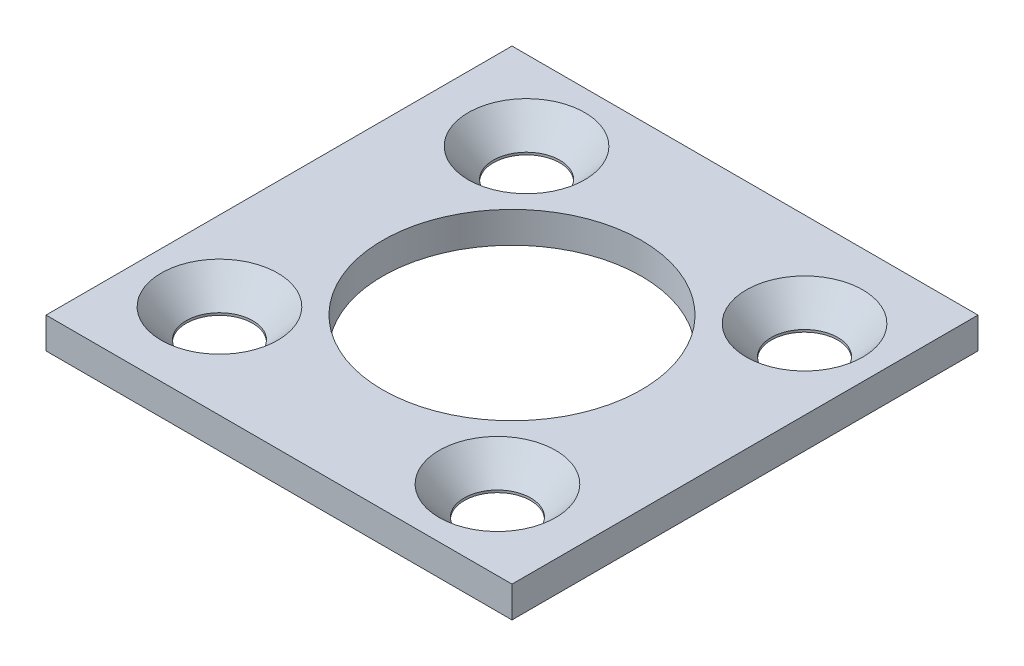
from build123d import *

# Parameters (mm, degrees)
SKETCH1_W                                     = 22.86
SKETCH1_H                                     = 22.86
SKETCH1_R                                     = 6.35
BOSS_EXTRUDE1_DEPTH                           = 1.524
CSK_FOR_4_FLAT_HEAD_MACHINE_SCREW1_AT_2_COUNT = 2
CSK_FOR_4_FLAT_HEAD_MACHINE_SCREW1_AT_2_PITCH = 14.368409794
CSK_FOR_4_FLAT_HEAD_MACHINE_SCREW1_AT_3_COUNT = 2
CSK_FOR_4_FLAT_HEAD_MACHINE_SCREW1_AT_3_PITCH = 20.32
CSK_FOR_4_FLAT_HEAD_MACHINE_SCREW1_AT_4_COUNT = 2
CSK_FOR_4_FLAT_HEAD_MACHINE_SCREW1_AT_4_PITCH = 14.368409794


with BuildPart() as part:
    # Sketch1 → Boss-Extrude1 (new body)
    with BuildSketch(Plane(origin=(0, 0, 0), x_dir=(1, 0, 0), z_dir=(0, 1, 0))):
        with Locations((-11.43, 11.43)):
            Rectangle(SKETCH1_W, SKETCH1_H)
        with Locations(Location((-11.43, 11.43, 0), (0, 0, 90))):
            Circle(SKETCH1_R, mode=Mode.SUBTRACT)
    extrude(amount=BOSS_EXTRUDE1_DEPTH)

    # Sketch3 → CSK for #4 Flat Head Machine Screw1 (revolve, cut)
    with BuildSketch(Plane(origin=(-3.897724655, 1.524, -18.248388969), x_dir=(0, 0, 1), z_dir=(1, 0, 0))):
        Polygon((0, 0), (0, 1.524), (1.63195, 1.524), (1.63195, 1.409834001), (2.8575, 0), align=None)
    csk_for_4_flat_head_machine_screw1 = revolve(axis=Axis((-3.897724655, 7.874, -18.248388969), (0, -1, 0)), mode=Mode.SUBTRACT)

    # CSK for #4 Flat Head Machine Screw1 at 2: CSK for #4 Flat Head Machine Screw1 ×2
    with Locations(*[Vector(-0.049684438764001596, 0, 0.99876496561739) * (i * CSK_FOR_4_FLAT_HEAD_MACHINE_SCREW1_AT_2_PITCH) for i in range(1, CSK_FOR_4_FLAT_HEAD_MACHINE_SCREW1_AT_2_COUNT)]):
        add(csk_for_4_flat_head_machine_screw1, mode=Mode.SUBTRACT)

    # CSK for #4 Flat Head Machine Screw1 at 3: CSK for #4 Flat Head Machine Screw1 ×2
    with Locations(*[Vector(-0.7413656835690785, 0, 0.6711012764301324) * (i * CSK_FOR_4_FLAT_HEAD_MACHINE_SCREW1_AT_3_PITCH) for i in range(1, CSK_FOR_4_FLAT_HEAD_MACHINE_SCREW1_AT_3_COUNT)]):
        add(csk_for_4_flat_head_machine_screw1, mode=Mode.SUBTRACT)

    # CSK for #4 Flat Head Machine Screw1 at 4: CSK for #4 Flat Head Machine Screw1 ×2
    with Locations(*[Vector(-0.99876496561739, 0, -0.04968443876400101) * (i * CSK_FOR_4_FLAT_HEAD_MACHINE_SCREW1_AT_4_PITCH) for i in range(1, CSK_FOR_4_FLAT_HEAD_MACHINE_SCREW1_AT_4_COUNT)]):
        add(csk_for_4_flat_head_machine_screw1, mode=Mode.SUBTRACT)


solid = part.part
